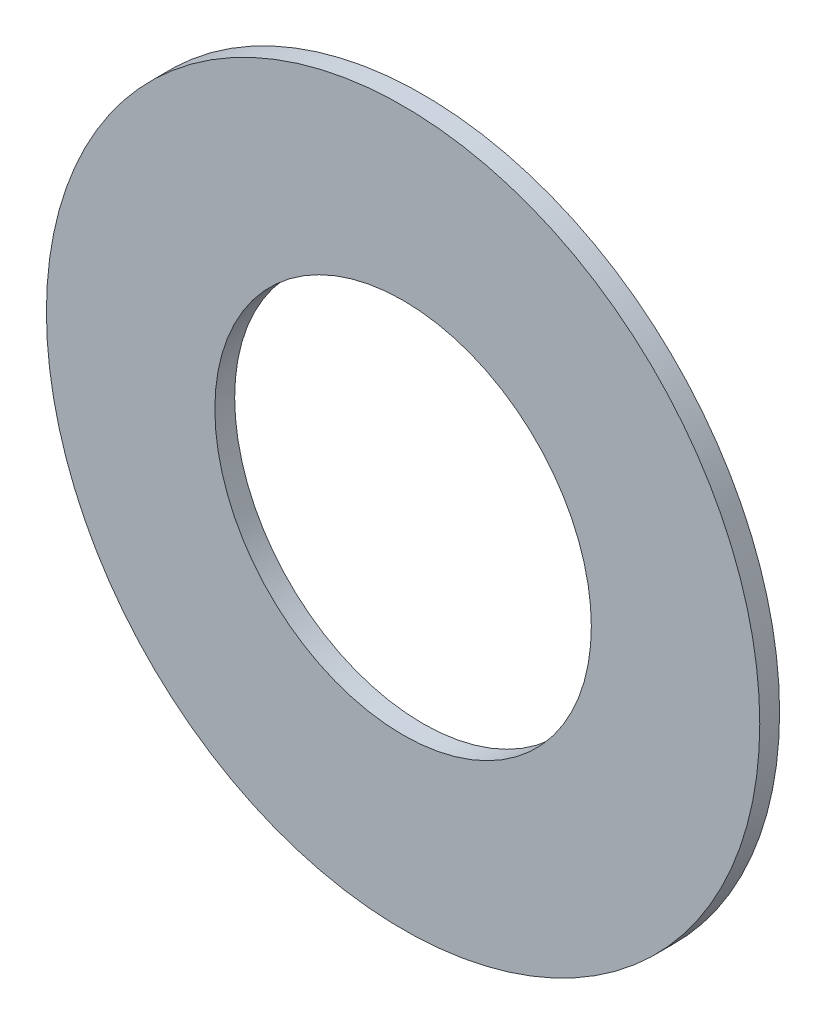
from build123d import *

# Parameters (mm, degrees)
SKETCH_1_R      = 54
SKETCH_1_R_2    = 28.5
EXTRUDE_1_DEPTH = 3


with BuildPart() as part:
    # Эскиз1 → Вытянуть1 (new body)
    with BuildSketch(Plane.XY):
        Circle(SKETCH_1_R)
        Circle(SKETCH_1_R_2, mode=Mode.SUBTRACT)
    extrude(amount=EXTRUDE_1_DEPTH)


solid = part.part
